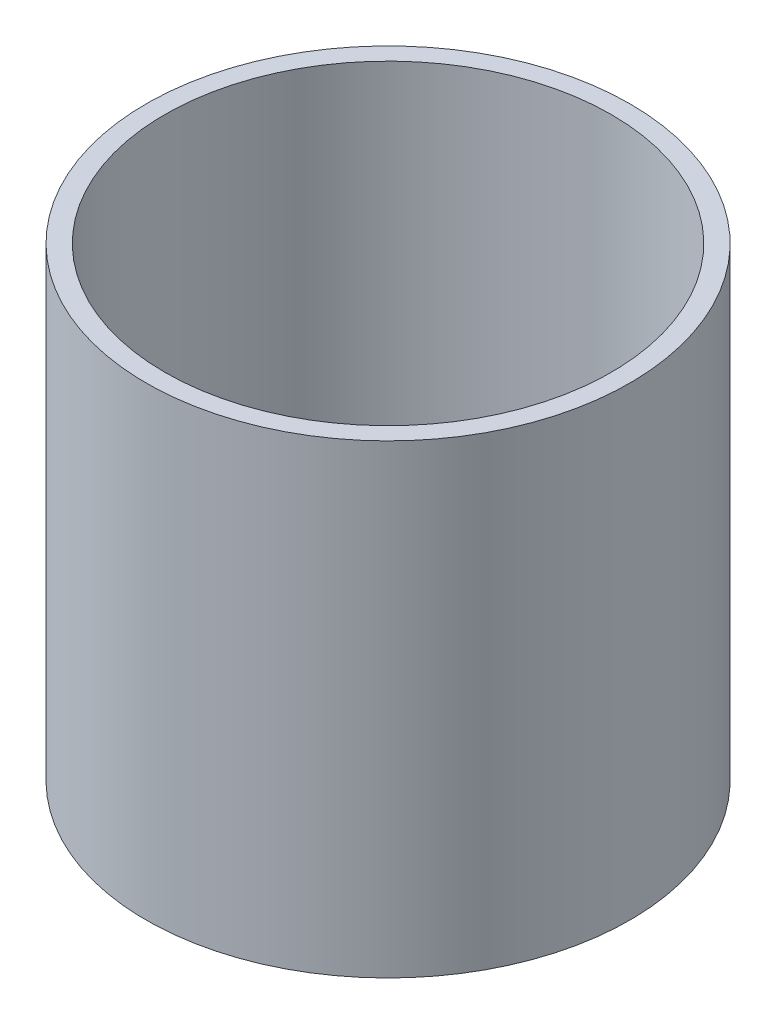
from build123d import *

# Parameters (mm, degrees)
SKETCH1_R           = 38.1
BOSS_EXTRUDE1_DEPTH = 76.2
SHELL2_T            = 3.175
SCALE1_SCALE        = 0.615384615


with BuildPart() as part:
    # Sketch1 → Boss-Extrude1 (new body)
    with BuildSketch(Plane(origin=(0, 0, 0), x_dir=(1, 0, 0), z_dir=(0, 1, 0))):
        with Locations(Location((0, 0, 0), (0, 0, 90))):
            Circle(SKETCH1_R)
    extrude(amount=BOSS_EXTRUDE1_DEPTH)

    # Shell2
    shell2_openings = [part.faces().sort_by_distance(p)[0] for p in [
        (0, 76.2, 0),
    ]]
    offset(amount=SHELL2_T, openings=shell2_openings, kind=Kind.INTERSECTION)


with BuildPart() as part_1:
    # Scale1: scaled about (0, 29.378039662, 0)
    add(part.part.scale(SCALE1_SCALE).moved(Location((0, 11.299246024, 0))))


solid = part_1.part
